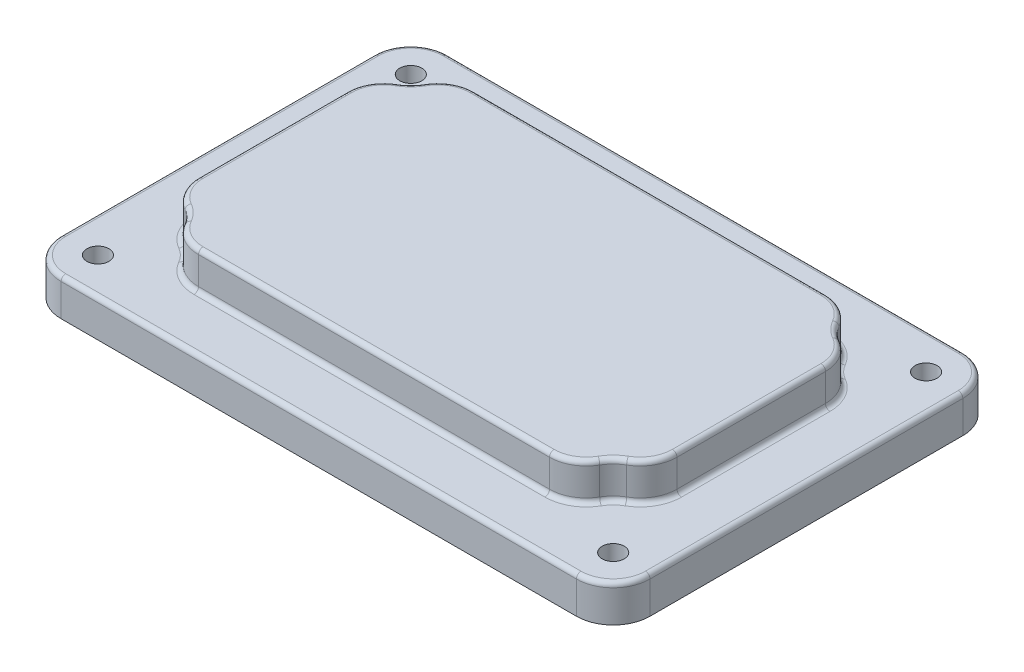
from build123d import *

# Parameters (mm, degrees)
BASE_DEPTH            = 6.35
SKETCH2_W             = 82.55
SKETCH2_H             = 47.625
TOP_BOSS_DEPTH        = 6.35
SKETCH3_R             = 6.35
CORNER_CUTS_DEPTH     = 6.35
FILLET1_R             = 6.35
SHELL1_T              = -3.175
SKETCH4_R             = 6.35
BOSS_EXTRUDE3_DEPTH   = 3.175
FILLET2_R             = 0.7874
FILLET3_R             = 0.7874
F_6_CLEARANCE_HOLE1_D = 3.7973


with BuildPart() as part:
    # Sketch1 → Base (new body)
    with BuildSketch(Plane(origin=(0, 0, 0), x_dir=(1, 0, 0), z_dir=(0, 1, 0))):
        with BuildLine():
            Line((-44.45, 33.3375), (44.45, 33.3375))
            ThreePointArc((44.45, 33.3375), (48.940128061, 31.477628061), (50.8, 26.9875))
            Line((50.8, 26.9875), (50.8, -26.9875))
            ThreePointArc((50.8, -26.9875), (48.940128061, -31.477628061), (44.45, -33.3375))
            Line((44.45, -33.3375), (-44.45, -33.3375))
            ThreePointArc((-44.45, -33.3375), (-48.940128061, -31.477628061), (-50.8, -26.9875))
            Line((-50.8, -26.9875), (-50.8, 26.9875))
            ThreePointArc((-50.8, 26.9875), (-48.940128061, 31.477628061), (-44.45, 33.3375))
        make_face()
    extrude(amount=BASE_DEPTH)

    # Sketch2 → Top Boss (add)
    with BuildSketch(Plane(origin=(0, 6.35, 0), x_dir=(1, 0, 0), z_dir=(0, 1, 0))):
        Rectangle(SKETCH2_W, SKETCH2_H)
    extrude(amount=TOP_BOSS_DEPTH)

    # Sketch3 → Corner Cuts (cut)
    with BuildSketch(Plane(origin=(0, 12.7, 0), x_dir=(1, 0, 0), z_dir=(0, 1, 0))):
        with Locations((41.275, 23.8125)):
            Circle(SKETCH3_R)
        with Locations((-41.275, 23.8125)):
            Circle(SKETCH3_R)
        with Locations((-41.275, -23.8125)):
            Circle(SKETCH3_R)
        with Locations((41.275, -23.8125)):
            Circle(SKETCH3_R)
    extrude(amount=-CORNER_CUTS_DEPTH, mode=Mode.SUBTRACT)

    # Fillet1
    fillet1_edges = [part.edges().sort_by_distance(p)[0] for p in [
        (41.275, 9.525, -17.4625),
        (34.925, 9.525, -23.8125),
        (-34.925, 9.525, -23.8125),
        (-41.275, 9.525, -17.4625),
        (-34.925, 9.525, 23.8125),
        (-41.275, 9.525, 17.4625),
        (34.925, 9.525, 23.8125),
        (41.275, 9.525, 17.4625),
    ]]
    fillet(fillet1_edges, radius=FILLET1_R)

    # Shell1
    shell1_openings = [part.faces().sort_by_distance(p)[0] for p in [
        (0, 0, 0),
    ]]
    offset(amount=SHELL1_T, openings=shell1_openings, kind=Kind.INTERSECTION)

    # Sketch4 → Boss-Extrude3 (add)
    with BuildSketch(Plane.XZ):
        with Locations((44.45, 26.9875)):
            Circle(SKETCH4_R)
        with Locations((-44.45, 26.9875)):
            Circle(SKETCH4_R)
        with Locations((-44.45, -26.9875)):
            Circle(SKETCH4_R)
        with Locations((44.45, -26.9875)):
            Circle(SKETCH4_R)
    extrude(amount=-BOSS_EXTRUDE3_DEPTH)

    # Fillet2
    fillet2_edges = [part.edges().sort_by_distance(p)[0] for p in [
        (48.940128061, 6.35, -31.477628061),
        (40.424261314, 6.35, -15.988977372),
        (33.451477372, 6.35, -22.961761314),
        (-33.451477372, 6.35, -22.961761314),
        (-40.424261314, 6.35, -15.988977372),
        (-40.424261314, 6.35, 15.988977372),
        (33.451477372, 6.35, 22.961761314),
        (40.424261314, 6.35, 15.988977372),
        (-33.451477372, 6.35, 22.961761314),
        (0, 6.35, -33.3375),
        (-48.940128061, 6.35, -31.477628061),
        (-50.8, 6.35, 0),
        (-48.940128061, 6.35, 31.477628061),
        (0, 6.35, 33.3375),
        (48.940128061, 6.35, 31.477628061),
        (50.8, 6.35, 0),
        (41.275, 12.7, 0),
        (41.275, 6.35, 0),
        (36.784871939, 12.7, 19.322371939),
        (36.784871939, 12.7, -19.322371939),
        (0, 12.7, -23.8125),
        (-36.784871939, 12.7, -19.322371939),
        (-41.275, 12.7, 0),
        (-36.784871939, 12.7, 19.322371939),
        (0, 12.7, 23.8125),
        (-33.451477372, 12.7, 22.961761314),
        (40.424261314, 12.7, 15.988977372),
        (33.451477372, 12.7, 22.961761314),
        (-40.424261314, 12.7, 15.988977372),
        (-40.424261314, 12.7, -15.988977372),
        (-33.451477372, 12.7, -22.961761314),
        (33.451477372, 12.7, -22.961761314),
        (40.424261314, 12.7, -15.988977372),
        (36.784871939, 6.35, -19.322371939),
        (0, 6.35, -23.8125),
        (-36.784871939, 6.35, -19.322371939),
        (-41.275, 6.35, 0),
        (-36.784871939, 6.35, 19.322371939),
        (0, 6.35, 23.8125),
        (36.784871939, 6.35, 19.322371939),
    ]]
    fillet(fillet2_edges, radius=FILLET2_R)

    # Fillet3
    fillet3_edges = [part.edges().sort_by_distance(p)[0] for p in [
        (37.674630657, 3.175, 14.401477372),
        (31.863977372, 3.175, 20.212130657),
        (-31.863977372, 3.175, 20.212130657),
        (-37.674630657, 3.175, 14.401477372),
        (-37.674630657, 3.175, -14.401477372),
        (-31.863977372, 3.175, -20.212130657),
        (31.863977372, 3.175, -20.212130657),
        (37.674630657, 3.175, -14.401477372),
        (0, 3.175, 20.6375),
        (38.1, 3.175, 0),
        (0, 3.175, -20.6375),
        (-38.1, 3.175, 0),
        (38.1, 9.525, 0),
        (37.674630657, 9.525, -14.401477372),
        (31.863977372, 9.525, -20.212130657),
        (0, 9.525, -20.6375),
        (-31.863977372, 9.525, -20.212130657),
        (-37.674630657, 9.525, -14.401477372),
        (-38.1, 9.525, 0),
        (-37.674630657, 9.525, 14.401477372),
        (-31.863977372, 9.525, 20.212130657),
        (0, 9.525, 20.6375),
        (31.863977372, 9.525, 20.212130657),
        (37.674630657, 9.525, 14.401477372),
        (34.539807909, 9.525, -17.077307909),
        (34.539807909, 3.175, -17.077307909),
        (-34.539807909, 9.525, -17.077307909),
        (-34.539807909, 3.175, -17.077307909),
        (-34.539807909, 9.525, 17.077307909),
        (-34.539807909, 3.175, 17.077307909),
        (34.539807909, 9.525, 17.077307909),
        (34.539807909, 3.175, 17.077307909),
        (38.950738686, 1.5875, 30.1625),
        (47.625, 0, 0),
        (47.625, 3.175, 0),
        (39.959871939, 0, 22.497371939),
        (39.959871939, 3.175, 22.497371939),
        (47.625, 1.5875, 21.488238686),
        (0, 0, 30.1625),
        (0, 3.175, 30.1625),
        (-38.950738686, 1.5875, 30.1625),
        (-39.959871939, 0, 22.497371939),
        (-47.625, 1.5875, 21.488238686),
        (-39.959871939, 3.175, 22.497371939),
        (-47.625, 0, 0),
        (-47.625, 3.175, 0),
        (-47.625, 1.5875, -21.488238686),
        (-39.959871939, 0, -22.497371939),
        (-38.950738686, 1.5875, -30.1625),
        (-39.959871939, 3.175, -22.497371939),
        (0, 0, -30.1625),
        (0, 3.175, -30.1625),
        (38.950738686, 1.5875, -30.1625),
        (39.959871939, 0, -22.497371939),
        (47.625, 1.5875, -21.488238686),
        (39.959871939, 3.175, -22.497371939),
    ]]
    fillet(fillet3_edges, radius=FILLET3_R)

    # #6 Clearance Hole1 (through all)
    with Locations(Plane(origin=(0, 6.35, 0), x_dir=(1, 0, 0), z_dir=(0, 1, 0))):
        with Locations((-44.45, 26.9875), (44.45, 26.9875), (44.45, -26.9875), (-44.45, -26.9875)):
            Hole(F_6_CLEARANCE_HOLE1_D / 2)


solid = part.part
